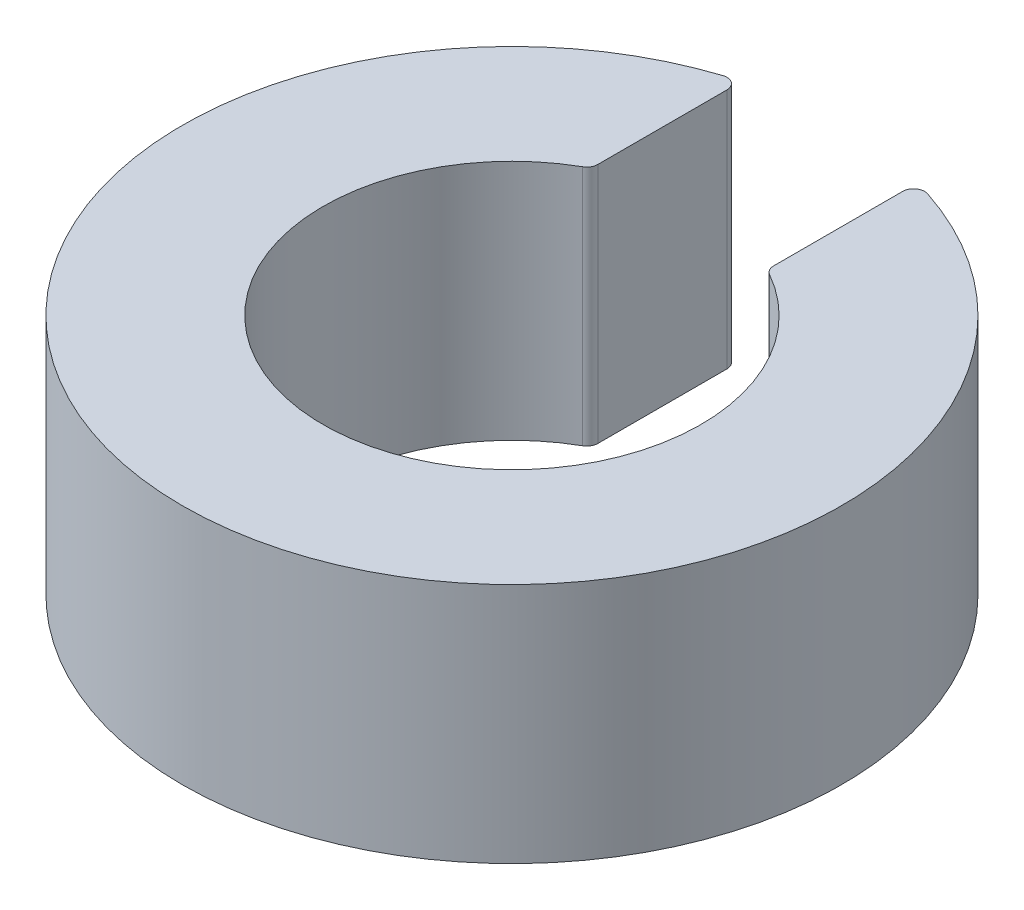
from build123d import *

# Parameters (mm, degrees)
BOSS_EXTRUDE1_DEPTH = 5.5
FILLET1_R           = 0.25


with BuildPart() as part:
    # Sketch1 → Boss-Extrude1 (new body)
    with BuildSketch(Plane(origin=(0, 0, 0), x_dir=(1, 0, 0), z_dir=(0, 1, 0))):
        with BuildLine():
            Line((-2, 3.806573262), (-2, 7.228416147))
            ThreePointArc((-2, 7.228416147), (-4.541475531, -5.968668193), (7.5, 0))
            ThreePointArc((7.5, 0), (5.968668193, 4.541475531), (2, 7.228416147))
            Line((2, 7.228416147), (2, 3.806573262))
            ThreePointArc((2, 3.806573262), (3.680353244, 2.223735596), (4.3, 0))
            ThreePointArc((4.3, 0), (-2.223735596, -3.680353244), (-2, 3.806573262))
        make_face()
    extrude(amount=BOSS_EXTRUDE1_DEPTH)

    # Fillet1
    fillet1_edges = [part.edges().sort_by_distance(p)[0] for p in [
        (2, 2.75, -3.806573262),
        (2, 2.75, -7.228416147),
        (-2, 2.75, -7.228416147),
        (-2, 2.75, -3.806573262),
    ]]
    fillet(fillet1_edges, radius=FILLET1_R)


solid = part.part
